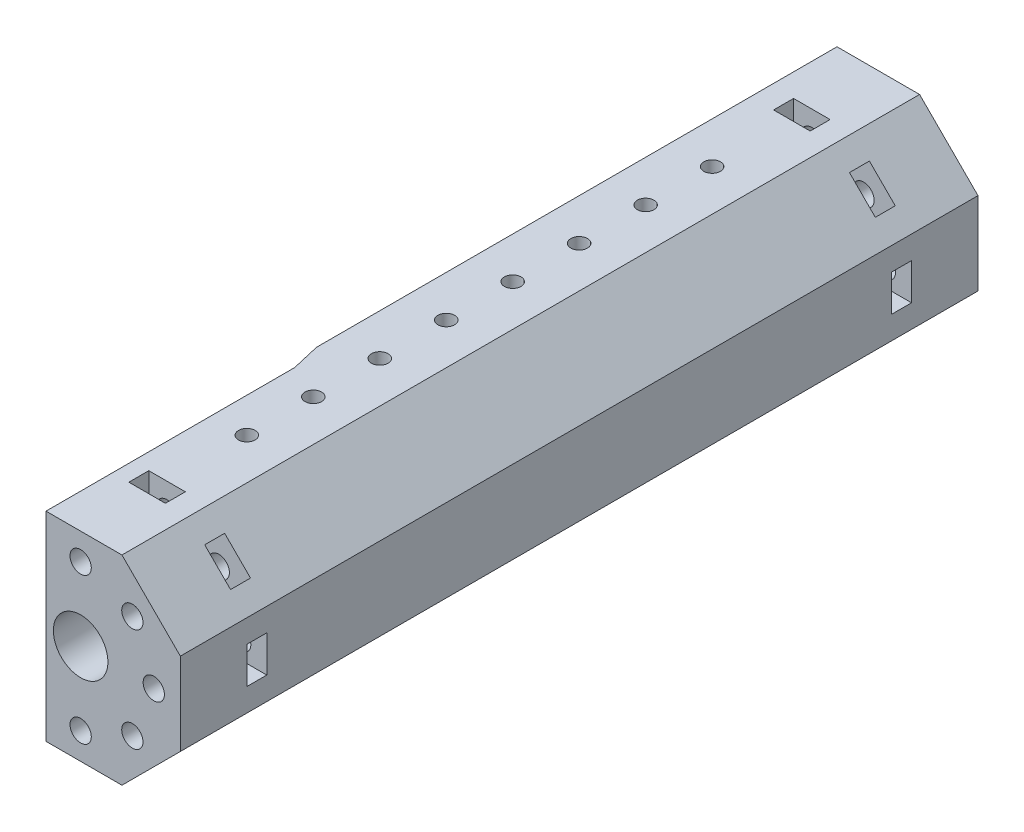
from build123d import *

# Parameters (mm, degrees)
SALIENTE_EXTRUIR1_DEPTH = 60
CROQUIS2_R              = 1.6
CORTAR_EXTRUIR1_DEPTH   = 20
CORTAR_EXTRUIR2_START   = -10
CORTAR_EXTRUIR2_DEPTH   = 3
CROQUIS4_R              = 4.1
CORTAR_EXTRUIR3_DEPTH   = 122.86057607
CORTAR_EXTRUIR4_DEPTH   = 125.599357944
CORTAR_EXTRUIR5_START   = -20
CROQUIS6_R              = 1.6
CORTAR_EXTRUIR5_DEPTH   = 20
CORTAR_EXTRUIR6_START   = -10
CORTAR_EXTRUIR6_DEPTH   = 3
CROQUIS8_R              = 1.25
CORTAR_EXTRUIR8_DEPTH   = 125.599357944
MATRIZL1_COUNT          = 8
MATRIZL1_PITCH          = 10
CHAFL_N1_SIZE           = 1


with BuildPart() as part:
    # Croquis1 → Saliente-Extruir1 (new body)
    with BuildSketch(Plane.XY):
        Polygon((15, -6.213203436), (15, 6.213203436), (6.213203436, 15), (-6.213203436, 15), (-15, 6.213203436), (-15, -6.213203436), (-6.213203436, -15), (6.213203436, -15), align=None)
    saliente_extruir1 = extrude(amount=SALIENTE_EXTRUIR1_DEPTH)

    # Croquis2 → Cortar-Extruir1 (cut)
    with BuildSketch(Plane(origin=(0, 0, 0), x_dir=(-1, 0, 0), z_dir=(0, 0, -1))):
        with Locations((0, 11)):
            Circle(CROQUIS2_R)
        with Locations((7.778174593, 7.778174593)):
            Circle(CROQUIS2_R)
        with Locations((11, 0)):
            Circle(CROQUIS2_R)
        with Locations((7.778174593, -7.778174593)):
            Circle(CROQUIS2_R)
        with Locations((0, -11)):
            Circle(CROQUIS2_R)
        with Locations((-7.778174593, -7.778174593)):
            Circle(CROQUIS2_R)
        with Locations((-11, 0)):
            Circle(CROQUIS2_R)
        with Locations((-7.778174593, 7.778174593)):
            Circle(CROQUIS2_R)
    extrude(amount=-CORTAR_EXTRUIR1_DEPTH, mode=Mode.SUBTRACT)

    # Croquis3 → Cortar-Extruir2 (cut)
    with BuildSketch(Plane(origin=(0, 0, 0), x_dir=(-1, 0, 0), z_dir=(0, 0, -1)).offset(CORTAR_EXTRUIR2_START)):
        Polygon((-2.75, 12.58771324), (-2.75, 18.463203436), (2.75, 23.963203436), (2.75, 12.58771324), (2.75, 9.41228676), (0, 7.824573519), (-2.75, 9.41228676), align=None)
        Polygon((6.956313744, 10.84540104), (11.110912703, 15), (18.889087297, 15), (10.84540104, 6.956313744), (8.600035443, 4.710948146), (5.532808996, 5.532808996), (4.710948146, 8.600035443), align=None)
        Polygon((12.58771324, 2.75), (18.463203436, 2.75), (23.963203436, -2.75), (12.58771324, -2.75), (9.41228676, -2.75), (7.824573519, 0), (9.41228676, 2.75), align=None)
        Polygon((10.84540104, -6.956313744), (15, -11.110912703), (15, -18.889087297), (6.956313744, -10.84540104), (4.710948146, -8.600035443), (5.532808996, -5.532808996), (8.600035443, -4.710948146), align=None)
        Polygon((2.75, -12.58771324), (2.75, -18.463203436), (-2.75, -23.963203436), (-2.75, -12.58771324), (-2.75, -9.41228676), (0, -7.824573519), (2.75, -9.41228676), align=None)
        Polygon((-6.956313744, -10.84540104), (-11.110912703, -15), (-18.889087297, -15), (-10.84540104, -6.956313744), (-8.600035443, -4.710948146), (-5.532808995, -5.532808996), (-4.710948146, -8.600035443), align=None)
        Polygon((-12.58771324, -2.75), (-18.463203436, -2.75), (-23.963203436, 2.75), (-12.58771324, 2.75), (-9.41228676, 2.75), (-7.824573519, 0), (-9.41228676, -2.75), align=None)
        Polygon((-10.84540104, 6.956313744), (-15, 11.110912703), (-15, 18.889087297), (-6.956313744, 10.84540104), (-4.710948146, 8.600035443), (-5.532808996, 5.532808996), (-8.600035443, 4.710948146), align=None)
    extrude(amount=-CORTAR_EXTRUIR2_DEPTH, mode=Mode.SUBTRACT)

    # Simetría1: Saliente-Extruir1 across plane
    add(saliente_extruir1.mirror(Plane.XY.offset(60)))

    # Croquis4 → Cortar-Extruir3 (cut, through all)
    with BuildSketch(Plane(origin=(0, 0, 0), x_dir=(-1, 0, 0), z_dir=(0, 0, -1))):
        Circle(CROQUIS4_R)
    extrude(amount=-CORTAR_EXTRUIR3_DEPTH, mode=Mode.SUBTRACT)

    # Croquis5 → Cortar-Extruir4 (cut, through all)
    with BuildSketch(Plane.XZ.offset(15)):
        Polygon((-6.213203436, 120), (-6.213203436, 78.298736304), (-15, 40.569524353), (-15, 120), align=None)
    extrude(amount=-CORTAR_EXTRUIR4_DEPTH, mode=Mode.SUBTRACT)

    # Croquis6 → Cortar-Extruir5 (cut)
    with BuildSketch(Plane.XY.offset(120).offset(CORTAR_EXTRUIR5_START)):
        with Locations(Location((0, 11, 0), (0, 0, 180))):
            Circle(CROQUIS6_R)
        with Locations(Location((7.778174593, 7.778174593, 0), (0, 0, 180))):
            Circle(CROQUIS6_R)
        with Locations(Location((11, 0, 0), (0, 0, 180))):
            Circle(CROQUIS6_R)
        with Locations(Location((7.778174593, -7.778174593, 0), (0, 0, 180))):
            Circle(CROQUIS6_R)
        with Locations(Location((0, -11, 0), (0, 0, 180))):
            Circle(CROQUIS6_R)
    extrude(amount=CORTAR_EXTRUIR5_DEPTH, mode=Mode.SUBTRACT)

    # Croquis7 → Cortar-Extruir6 (cut)
    with BuildSketch(Plane.XY.offset(120).offset(CORTAR_EXTRUIR6_START)):
        Polygon((-2.75, 12.58771324), (-2.75, 18.463203436), (2.75, 23.963203436), (2.75, 12.58771324), (2.75, 9.41228676), (0, 7.824573519), (-2.75, 9.41228676), align=None)
        Polygon((6.956313744, 10.84540104), (11.110912703, 15), (18.889087297, 15), (10.84540104, 6.956313744), (8.600035443, 4.710948146), (5.532808996, 5.532808996), (4.710948146, 8.600035443), align=None)
        Polygon((12.58771324, 2.75), (18.463203436, 2.75), (23.963203436, -2.75), (12.58771324, -2.75), (9.41228676, -2.75), (7.824573519, 0), (9.41228676, 2.75), align=None)
        Polygon((10.84540104, -6.956313744), (15, -11.110912703), (15, -18.889087297), (6.956313744, -10.84540104), (4.710948146, -8.600035443), (5.532808996, -5.532808996), (8.600035443, -4.710948146), align=None)
        Polygon((2.75, -12.58771324), (2.75, -18.463203436), (-2.75, -23.963203436), (-2.75, -12.58771324), (-2.75, -9.41228676), (0, -7.824573519), (2.75, -9.41228676), align=None)
    extrude(amount=-CORTAR_EXTRUIR6_DEPTH, mode=Mode.SUBTRACT)

    # Croquis8 → Cortar-Extruir8 (cut, through all)
    with BuildSketch(Plane.XZ.offset(15)):
        with Locations((0, 25)):
            Circle(CROQUIS8_R)
    cortar_extruir8 = extrude(amount=-CORTAR_EXTRUIR8_DEPTH, mode=Mode.SUBTRACT)

    # MatrizL1: Cortar-Extruir8 ×8
    with Locations(*[(0, 0, i * MATRIZL1_PITCH) for i in range(1, MATRIZL1_COUNT)]):
        add(cortar_extruir8, mode=Mode.SUBTRACT)

    # Chaflán1
    chafl_n1_edges = [part.edges().sort_by_distance(p)[0] for p in [
        (-6.213203436, -15, 99.149368152),
        (-6.213203436, 15, 99.149368152),
        (-6.213203436, 0, 120),
    ]]
    chamfer(chafl_n1_edges, length=CHAFL_N1_SIZE)


solid = part.part
